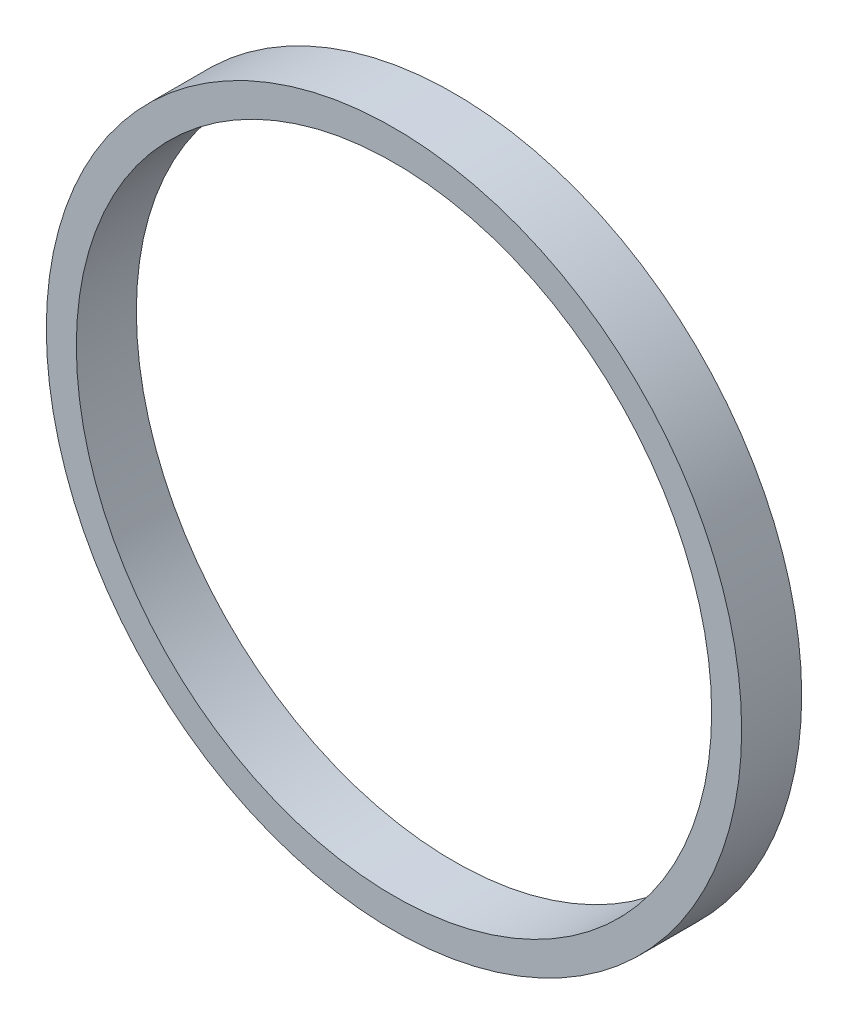
from build123d import *

# Parameters (mm, degrees)
SKETCH2_R           = 44.1325
BOSS_EXTRUDE2_DEPTH = 7.62
SKETCH3_R           = 40.3225
CUT_EXTRUDE1_DEPTH  = 7.62


with BuildPart() as part:
    # Sketch2 → Boss-Extrude2 (new body)
    with BuildSketch(Plane.XY):
        with Locations(Location((0, 0, 0), (0, 0, 180))):
            Circle(SKETCH2_R)
    extrude(amount=BOSS_EXTRUDE2_DEPTH)

    # Sketch3 → Cut-Extrude1 (cut)
    with BuildSketch(Plane(origin=(0, 0, 0), x_dir=(-1, 0, 0), z_dir=(0, 0, -1))):
        Circle(SKETCH3_R)
    extrude(amount=-CUT_EXTRUDE1_DEPTH, mode=Mode.SUBTRACT)


solid = part.part
